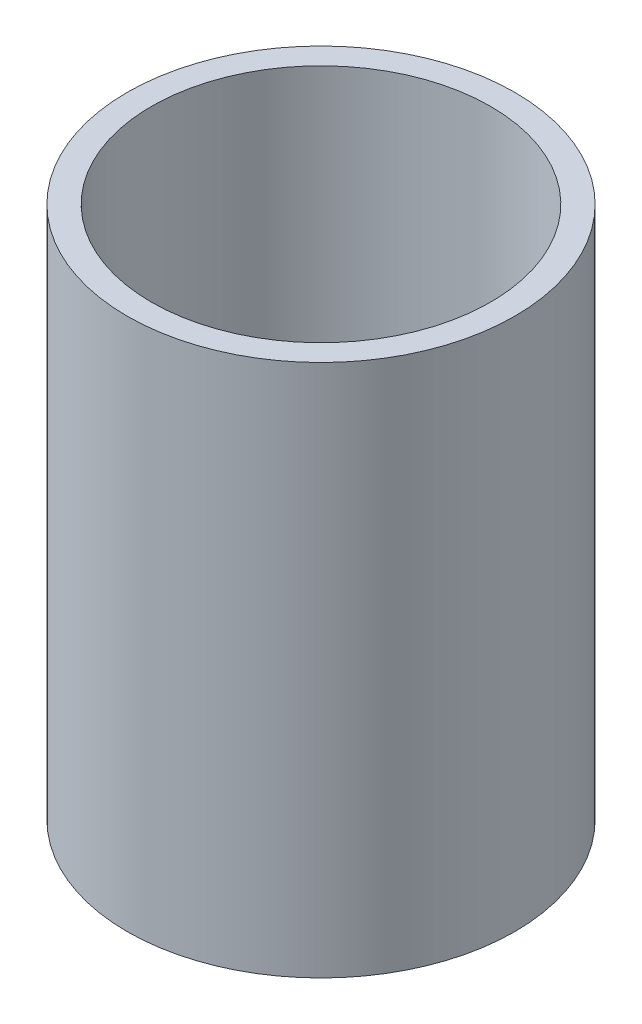
from build123d import *

# Parameters (mm, degrees)
SKETCH2_R           = 40
SKETCH2_R_2         = 35
BOSS_EXTRUDE1_DEPTH = 110


with BuildPart() as part:
    # Sketch2 → Boss-Extrude1 (new body)
    with BuildSketch(Plane(origin=(0, 0, 0), x_dir=(1, 0, 0), z_dir=(0, 1, 0))):
        with Locations(Location((0, 0, 0), (0, 0, 270))):
            Circle(SKETCH2_R)
        with Locations(Location((0, 0, 0), (0, 0, 270))):
            Circle(SKETCH2_R_2, mode=Mode.SUBTRACT)
    extrude(amount=BOSS_EXTRUDE1_DEPTH)


solid = part.part
